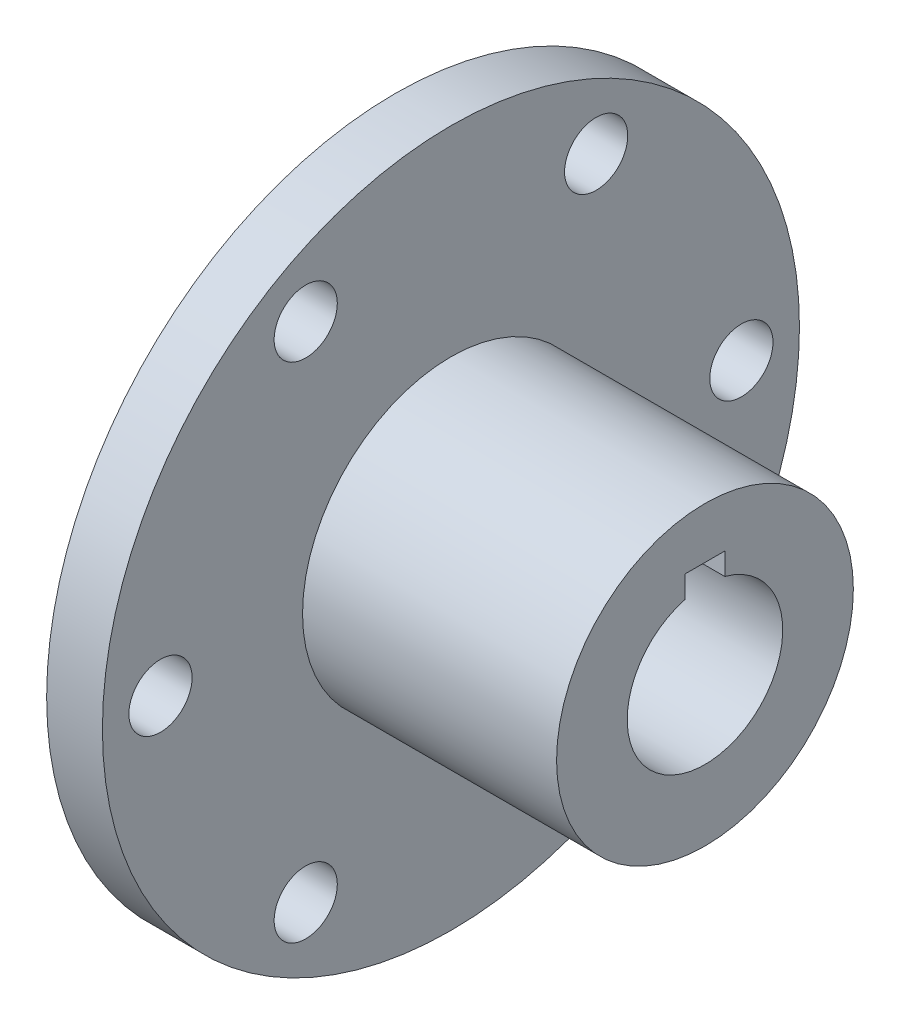
from build123d import *

# Parameters (mm, degrees)
SKETCH1_W           = 4.572
SKETCH1_H           = 28.575
SKETCH2_R           = 12.1666
BOSS_EXTRUDE1_DEPTH = 20.828
CUT_EXTRUDE1_DEPTH  = 48.730716001
SKETCH4_W           = 25.4
SKETCH4_H           = 6.3754
HOLE1_D             = 5.1816
HOLE1_DEPTH         = 25.4


with BuildPart() as part:
    # Sketch1 → Revolve1 (revolve)
    with BuildSketch(Plane.XY, mode=Mode.PRIVATE) as revolve1_sk:
        with Locations((-15.321066246, 14.2875)):
            Rectangle(SKETCH1_W, SKETCH1_H)
    revolve(revolve1_sk.sketch.rotate(Axis((-17.607066246, 0, 0), (1, 0, 0)), 270), axis=Axis((-17.607066246, 0, 0), (1, 0, 0)))

    # Sketch2 → Boss-Extrude1 (add)
    with BuildSketch(Plane(origin=(-13.035066246, 0, 0), x_dir=(0, 0, -1), z_dir=(1, 0, 0))):
        Circle(SKETCH2_R)
    extrude(amount=BOSS_EXTRUDE1_DEPTH)

    # Sketch3 → Cut-Extrude1 (cut, through all)
    with BuildSketch(Plane.ZY.offset(17.607066246)):
        with BuildLine():
            Line((1.6256, 6.16466948), (1.6256, 7.9756))
            Line((1.6256, 7.9756), (-1.6256, 7.9756))
            Line((-1.6256, 7.9756), (-1.6256, 6.16466948))
            ThreePointArc((-1.6256, 6.16466948), (0, 6.3754), (1.6256, 6.16466948))
        make_face()
    extrude(amount=-CUT_EXTRUDE1_DEPTH, mode=Mode.SUBTRACT)

    # Sketch4 → Cut-Revolve1 (revolve, cut)
    with BuildSketch(Plane(origin=(0, 0, 0), x_dir=(-1, 0, 0), z_dir=(0, 0, -1))):
        with Locations((4.907066246, 3.1877)):
            Rectangle(SKETCH4_W, SKETCH4_H)
    revolve(axis=Axis((7.792933754, 0, 0), (-1, 0, 0)), mode=Mode.SUBTRACT)

    # Hole1
    with Locations(Plane.ZY.offset(17.607066246)):
        with Locations((23.8125, 0), (11.90625, 20.622229928), (-11.90625, 20.622229928), (-23.8125, 0), (-11.90625, -20.622229928), (11.90625, -20.622229928)):
            Hole(HOLE1_D / 2, depth=HOLE1_DEPTH)


solid = part.part
